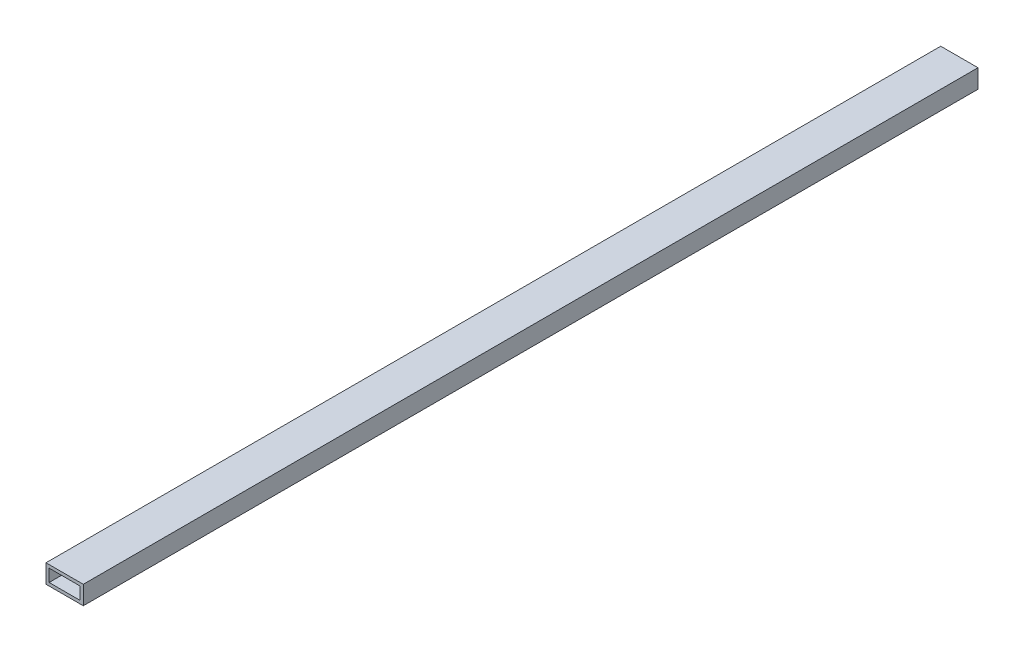
from build123d import *

# Parameters (mm, degrees)
BOSS_EXTRUDE1_DEPTH      = 457.2
BOSS_EXTRUDE1_DEPTH_BACK = 457.2
SKETCH3_W                = 38.1
SKETCH3_H                = 19.05
SKETCH3_W_2              = 31.75
SKETCH3_H_2              = 12.7


with BuildPart() as part:
    # Sketch3 → Boss-Extrude1 (new, two sides: drawn at the far end of the back side and taken through both)
    with BuildSketch(Plane.XY.offset(-BOSS_EXTRUDE1_DEPTH_BACK)):
        Rectangle(SKETCH3_W, SKETCH3_H)
        Rectangle(SKETCH3_W_2, SKETCH3_H_2, mode=Mode.SUBTRACT)
    extrude(amount=BOSS_EXTRUDE1_DEPTH + BOSS_EXTRUDE1_DEPTH_BACK)


solid = part.part
